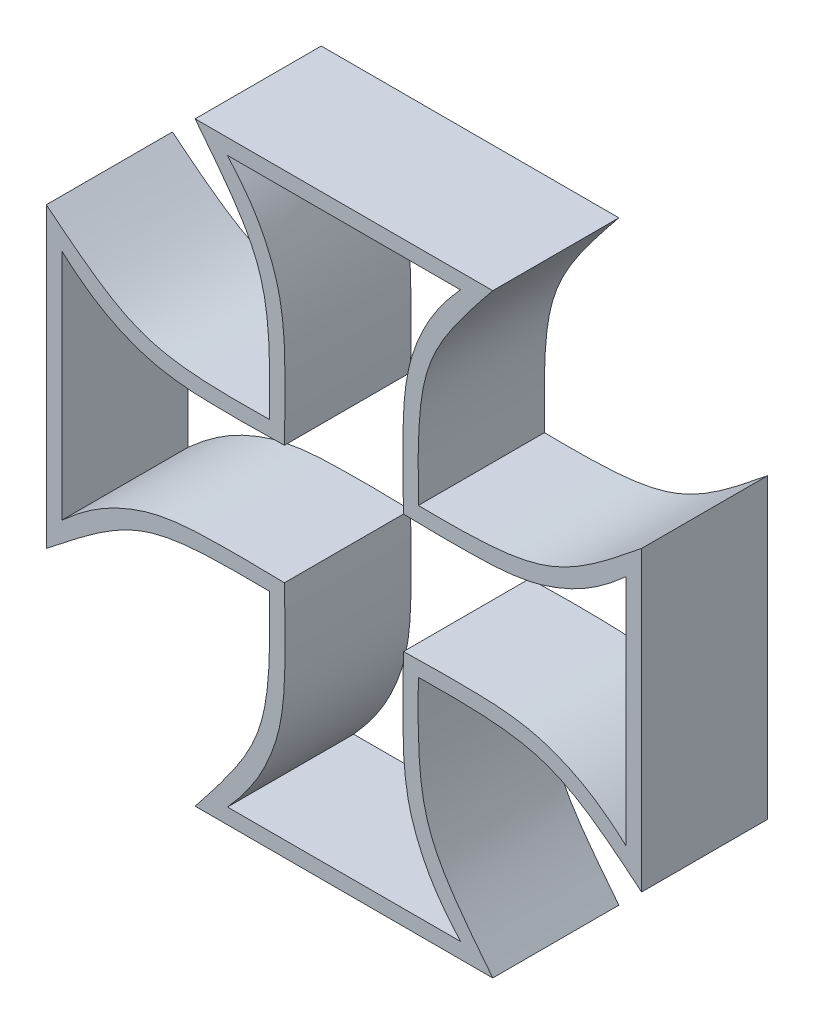
from build123d import *

# Parameters (mm, degrees)
BOSS_EXTRUDE2_DEPTH = 10


with BuildPart() as part:
    # Sketch2 → Boss-Extrude2 (new body)
    with BuildSketch(Plane.XY):
        with BuildLine():
            Line((-14.603718032, -4.25226485), (-14.603718032, -16.05226485))
            add(Edge.make_bspline(
                [(-14.603718032, -16.05226485), (-7.650885271, -10.51974289), (-6.514940021, -10.02158081), (3.096281968, -10.15226485)],
                knots=[0, 0, 0, 0, 1, 1, 1, 1], degree=3))
            add(Edge.make_bspline(
                [(-2.803718032, -27.85226485), (2.703196059, -20.905107597), (3.226966008, -19.763486839), (3.096281968, -10.15226485)],
                knots=[0, 0, 0, 0, 1, 1, 1, 1], degree=3))
            Line((-2.803718032, -27.85226485), (8.996281968, -27.85226485))
            Line((8.996281968, -27.85226485), (20.796281968, -27.85226485))
            add(Edge.make_bspline(
                [(20.796281968, -27.85226485), (15.289367876, -20.905107597), (14.765597927, -19.763486839), (14.896281968, -10.15226485)],
                knots=[0, 0, 0, 0, 1, 1, 1, 1], degree=3))
            add(Edge.make_bspline(
                [(32.596281968, -16.05226485), (26.075718291, -10.636722115), (24.507503956, -10.02158081), (14.896281968, -10.15226485)],
                knots=[0, 0, 0, 0, 1, 1, 1, 1], degree=3))
            Line((32.596281968, -16.05226485), (32.596281968, -4.25226485))
            Line((32.596281968, -4.25226485), (32.596281968, 7.54773515))
            add(Edge.make_bspline(
                [(32.596281968, 7.54773515), (26.060239224, 2.204460741), (24.507503956, 1.517051109), (14.896281968, 1.64773515)],
                knots=[0, 0, 0, 0, 1, 1, 1, 1], degree=3))
            add(Edge.make_bspline(
                [(20.796281968, 19.34773515), (15.17794478, 12.385242856), (14.765597927, 11.258957138), (14.896281968, 1.64773515)],
                knots=[0, 0, 0, 0, 1, 1, 1, 1], degree=3))
            Line((20.796281968, 19.34773515), (8.996281968, 19.34773515))
            Line((8.996281968, 19.34773515), (-2.803718032, 19.34773515))
            add(Edge.make_bspline(
                [(-2.803718032, 19.34773515), (2.703196059, 12.400577896), (3.226966008, 11.258957138), (3.096281968, 1.64773515)],
                knots=[0, 0, 0, 0, 1, 1, 1, 1], degree=3))
            add(Edge.make_bspline(
                [(-14.603718032, 7.54773515), (-7.778459348, 2.057713254), (-6.514940021, 1.517051109), (3.096281968, 1.64773515)],
                knots=[0, 0, 0, 0, 1, 1, 1, 1], degree=3))
            Line((-14.603718032, 7.54773515), (-14.603718032, -4.25226485))
        make_face()
        with BuildLine():
            Line((-13.367049291, 4.983848061), (-13.359836789, -13.486904263))
            add(Edge.make_bspline(
                [(4.276281968, -8.97226485), (1.357073523, -8.890997253), (-1.10755969, -8.938924224), (-3.619280473, -8.98035494), (-5.824591621, -9.280620978), (-9.544119387, -10.53795077), (-11.468926051, -11.789350434), (-13.359836789, -13.486904263)],
                knots=[0, 0, 0, 0, 0.101134443, 0.143755275, 0.394824647, 0.483587486, 1, 1, 1, 1], degree=3))
            add(Edge.make_bspline(
                [(4.276281968, -8.97226485), (4.357549565, -11.891473295), (4.312899482, -14.379398557), (4.269706875, -16.878595862), (3.970794846, -19.093531277), (2.713078522, -22.810311581), (1.461925113, -24.736868618), (-0.235628716, -26.627779357)],
                knots=[0, 0, 0, 0, 0.101134443, 0.143755275, 0.394824647, 0.483587486, 1, 1, 1, 1], degree=3))
            Line((-0.235628716, -26.627779357), (18.235123608, -26.620566855))
            add(Edge.make_bspline(
                [(13.716281968, -8.97226485), (13.63501437, -11.891473295), (13.68798773, -14.370737178), (13.726705146, -16.874591462), (14.02905635, -19.085947998), (15.285790884, -22.803749973), (16.537569779, -24.729656117), (18.235123608, -26.620566855)],
                knots=[0, 0, 0, 0, 0.101134443, 0.143755275, 0.394824647, 0.483587486, 1, 1, 1, 1], degree=3))
            add(Edge.make_bspline(
                [(13.716281968, -8.97226485), (16.635490412, -8.890997253), (19.110199259, -8.940518851), (21.616502658, -8.981092181), (23.825977054, -9.282017119), (27.544316328, -10.539158813), (29.469880166, -11.790678311), (31.360790904, -13.48823214)],
                knots=[0, 0, 0, 0, 0.101134443, 0.143755275, 0.394824647, 0.483587486, 1, 1, 1, 1], degree=3))
            Line((31.360790904, -13.48823214), (31.353578402, 4.982520183))
            add(Edge.make_bspline(
                [(13.716281968, 0.46773515), (16.635490412, 0.386467552), (19.10153788, 0.434569398), (21.612498258, 0.475906089), (23.818393775, 0.776244385), (27.53775472, 2.033553549), (29.462667664, 3.284966355), (31.353578402, 4.982520183)],
                knots=[0, 0, 0, 0, 0.101134443, 0.143755275, 0.394824647, 0.483587486, 1, 1, 1, 1], degree=3))
            add(Edge.make_bspline(
                [(13.716281968, 0.46773515), (13.63501437, 3.386943594), (13.67947956, 5.875636617), (13.722771578, 8.374421119), (14.02160721, 10.589673773), (15.279345343, 14.306363513), (16.530484858, 16.232978248), (18.228038687, 18.123888986)],
                knots=[0, 0, 0, 0, 0.101134443, 0.143755275, 0.394824647, 0.483587486, 1, 1, 1, 1], degree=3))
            Line((18.228038687, 18.123888986), (-0.242713637, 18.116676484))
            add(Edge.make_bspline(
                [(4.276281968, 0.46773515), (4.357549565, 3.386943594), (4.304391311, 5.866975238), (4.265773308, 8.370416719), (3.963345706, 10.582090494), (2.706632981, 14.299801905), (1.454840192, 16.225765746), (-0.242713637, 18.116676484)],
                knots=[0, 0, 0, 0, 0.101134443, 0.143755275, 0.394824647, 0.483587486, 1, 1, 1, 1], degree=3))
            add(Edge.make_bspline(
                [(4.276281968, 0.46773515), (1.357073523, 0.386467552), (-1.116221069, 0.436164025), (-3.623284873, 0.47664333), (-5.8321749, 0.777640526), (-9.550680995, 2.034761592), (-11.476138553, 3.286294232), (-13.367049291, 4.983848061)],
                knots=[0, 0, 0, 0, 0.101134443, 0.143755275, 0.394824647, 0.483587486, 1, 1, 1, 1], degree=3))
        make_face(mode=Mode.SUBTRACT)
    extrude(amount=BOSS_EXTRUDE2_DEPTH)


solid = part.part
